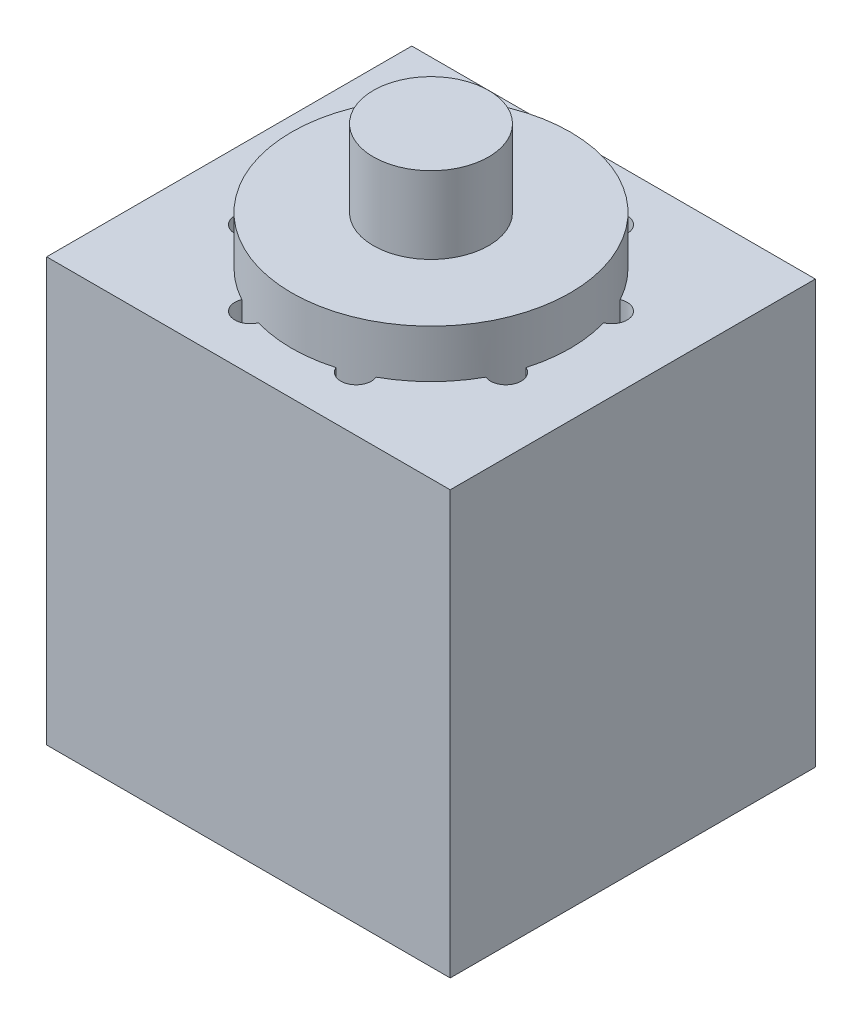
from build123d import *

# Parameters (mm, degrees)
F_01_HOUSING_PROFILE_W        = 210
F_01_HOUSING_PROFILE_H        = 190
F_01_HOUSING_PROFILE_R        = 8
F_01_HOUSING_BLOCK_DEPTH      = 220
F_02_FACE_BOSS_PROFILE_R      = 72.5
F_02_FACE_LOCATING_BOSS_DEPTH = 245
F_03_OUTPUT_SHAFT_PROFILE_R   = 30
F_03_OUTPUT_SHAFT_DEPTH       = 285


with BuildPart() as part:
    # 01_Housing_Profile → 01_Housing_Block (new body)
    with BuildSketch(Plane(origin=(0, 0, 0), x_dir=(1, 0, 0), z_dir=(0, 1, 0))):
        Rectangle(F_01_HOUSING_PROFILE_W, F_01_HOUSING_PROFILE_H)
        with Locations(Location((66.519326341, 27.55320713, 0), (0, 0, 270))):
            Circle(F_01_HOUSING_PROFILE_R, mode=Mode.SUBTRACT)
        with Locations(Location((27.55320713, 66.519326341, 0), (0, 0, 270))):
            Circle(F_01_HOUSING_PROFILE_R, mode=Mode.SUBTRACT)
        with Locations(Location((-27.55320713, 66.519326341, 0), (0, 0, 270))):
            Circle(F_01_HOUSING_PROFILE_R, mode=Mode.SUBTRACT)
        with Locations(Location((-66.519326341, 27.55320713, 0), (0, 0, 270))):
            Circle(F_01_HOUSING_PROFILE_R, mode=Mode.SUBTRACT)
        with Locations(Location((-66.519326341, -27.55320713, 0), (0, 0, 270))):
            Circle(F_01_HOUSING_PROFILE_R, mode=Mode.SUBTRACT)
        with Locations(Location((-27.55320713, -66.519326341, 0), (0, 0, 270))):
            Circle(F_01_HOUSING_PROFILE_R, mode=Mode.SUBTRACT)
        with Locations(Location((27.55320713, -66.519326341, 0), (0, 0, 270))):
            Circle(F_01_HOUSING_PROFILE_R, mode=Mode.SUBTRACT)
        with Locations(Location((66.519326341, -27.55320713, 0), (0, 0, 270))):
            Circle(F_01_HOUSING_PROFILE_R, mode=Mode.SUBTRACT)
    extrude(amount=F_01_HOUSING_BLOCK_DEPTH)

    # 02_Face_Boss_Profile → 02_Face_Locating_Boss (add)
    with BuildSketch(Plane(origin=(0, 0, 0), x_dir=(1, 0, 0), z_dir=(0, 1, 0))):
        with Locations(Location((0, 0, 0), (0, 0, 73.835030621))):
            Circle(F_02_FACE_BOSS_PROFILE_R)
    extrude(amount=F_02_FACE_LOCATING_BOSS_DEPTH)

    # 03_Output_Shaft_Profile → 03_Output_Shaft (add)
    with BuildSketch(Plane(origin=(0, 0, 0), x_dir=(1, 0, 0), z_dir=(0, 1, 0))):
        with Locations(Location((0, 0, 0), (0, 0, 270))):
            Circle(F_03_OUTPUT_SHAFT_PROFILE_R)
    extrude(amount=F_03_OUTPUT_SHAFT_DEPTH)


solid = part.part
